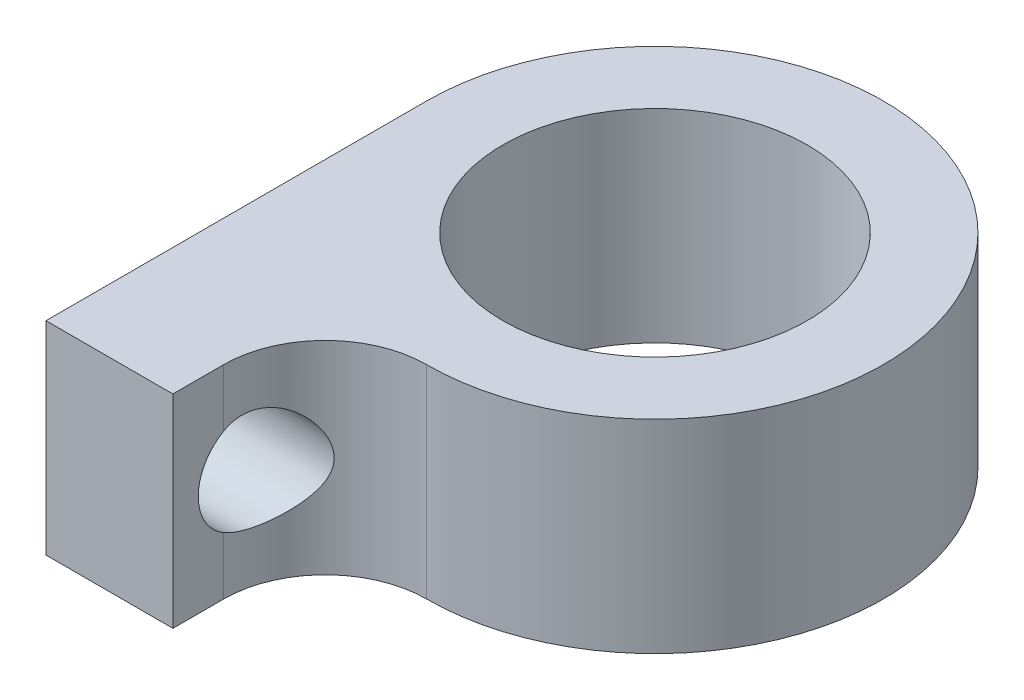
from build123d import *

# Parameters (mm, degrees)
CROQUIS1_R              = 6
SALIENTE_EXTRUIR1_DEPTH = 8
CROQUIS3_R              = 2
CORTAR_EXTRUIR1_DEPTH   = 10


with BuildPart() as part:
    # Croquis1 → Saliente-Extruir1 (new body)
    with BuildSketch(Plane(origin=(0, 0, 0), x_dir=(1, 0, 0), z_dir=(0, 1, 0))):
        with BuildLine():
            Line((-9, 0), (-9, -15))
            Line((-9, -15), (-4, -15))
            Line((-4, -15), (-4, -13))
            ThreePointArc((-4, -13), (-2.828427125, -10.171572875), (0, -9))
            ThreePointArc((0, -9), (6.363961031, 6.363961031), (-9, 0))
        make_face()
        with Locations(Location((0, 0, 0), (0, 0, 270))):
            Circle(CROQUIS1_R, mode=Mode.SUBTRACT)
    extrude(amount=SALIENTE_EXTRUIR1_DEPTH)

    # Croquis3 → Cortar-Extruir1 (cut)
    with BuildSketch(Plane.ZY.offset(9)):
        with Locations((12, 4)):
            Circle(CROQUIS3_R)
    extrude(amount=-CORTAR_EXTRUIR1_DEPTH, mode=Mode.SUBTRACT)


solid = part.part
